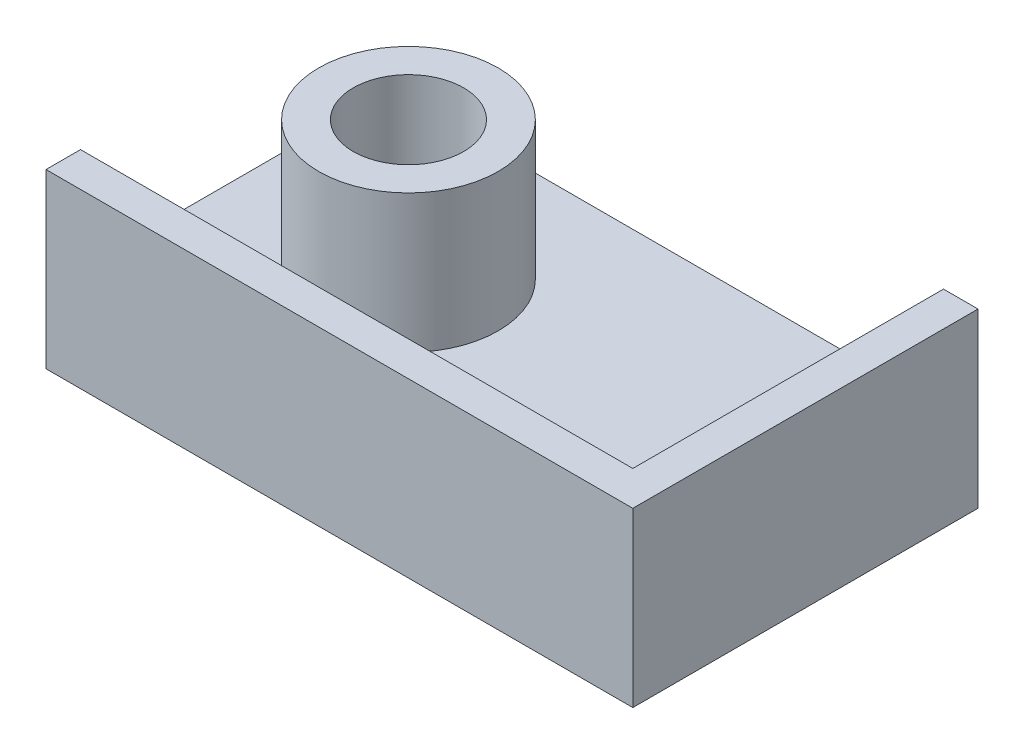
from build123d import *

# Parameters (mm, degrees)
SKETCH_1_W           = 16
SKETCH_1_H           = 9
EXTRUDE_1_DEPTH      = 2
SKETCH_2_R           = 2.6
EXTRUDE_2_DEPTH      = 4
EXTRUDE_3_DEPTH      = 3
EXTRUDE_3_DEPTH_BACK = 2
SKETCH_4_R           = 1.6
CUT_EXTRUDE_1_DEPTH  = 13.1346611


with BuildPart() as part:
    # 草图1 → 凸台-拉伸1 (new body)
    with BuildSketch(Plane(origin=(0, 0, 0), x_dir=(1, 0, 0), z_dir=(0, 1, 0))):
        Rectangle(SKETCH_1_W, SKETCH_1_H)
    extrude(amount=EXTRUDE_1_DEPTH)

    # 草图2 → 凸台-拉伸2 (add)
    with BuildSketch(Plane(origin=(0, 2, 0), x_dir=(1, 0, 0), z_dir=(0, 1, 0))):
        with Locations(Location((-3, 0, 0), (0, 0, 90))):
            Circle(SKETCH_2_R)
    extrude(amount=EXTRUDE_2_DEPTH)

    # 草图3 → 凸台-拉伸3 (add, two sides: drawn at the far end of the back side and taken through both)
    with BuildSketch(Plane(origin=(0, 2, 0), x_dir=(1, 0, 0), z_dir=(0, 1, 0)).offset(-EXTRUDE_3_DEPTH_BACK)):
        Polygon((-8, -4.5), (-8, -5.5), (9, -5.5), (9, 4.5), (8, 4.5), (8, -4.5), align=None)
    extrude(amount=EXTRUDE_3_DEPTH + EXTRUDE_3_DEPTH_BACK)

    # 草图4 → 切除-拉伸1 (cut, through all)
    with BuildSketch(Plane(origin=(0, 6, 0), x_dir=(1, 0, 0), z_dir=(0, 1, 0))):
        with Locations(Location((-3, 0, 0), (0, 0, 270))):
            Circle(SKETCH_4_R)
    extrude(amount=-CUT_EXTRUDE_1_DEPTH, mode=Mode.SUBTRACT)


solid = part.part
